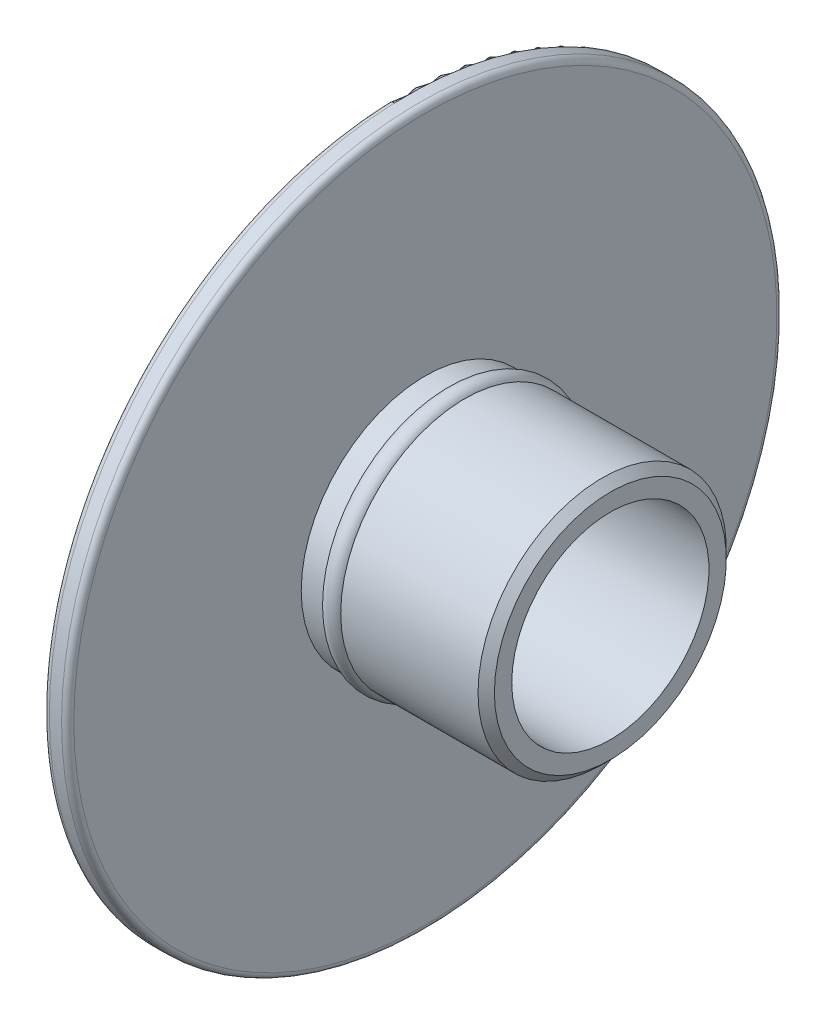
from build123d import *

# Parameters (mm, degrees)
SKETCH2_W          = 1.2
SKETCH2_H          = 12.675438596
CHAMFER2_SIZE      = 0.4
FILLET1_R          = 0.3
CUT_EXTRUDE2_DEPTH = 0.6
FILLET2_R          = 0.3


with BuildPart() as part:
    # Sketch2 → Revolve1 (revolve)
    with BuildSketch(Plane.XY):
        with Locations((-5.85, 11.162280702)):
            Rectangle(SKETCH2_W, SKETCH2_H)
    revolve(axis=Axis((0, 0, 0), (1, 0, 0)))

    # Sketch4 → Revolve2 (revolve)
    with BuildSketch(Plane.XY):
        with BuildLine():
            Line((-5.25, 6.074561404), (-5.25, 4.824561404))
            Line((-5.25, 4.824561404), (3.8, 4.824561404))
            Line((3.8, 4.824561404), (3.8, 6.074561404))
            Line((3.8, 6.074561404), (-3.316987298, 6.074561404))
            ThreePointArc((-3.316987298, 6.074561404), (-3.75, 6.324561404), (-4.183012702, 6.074561404))
            Line((-4.183012702, 6.074561404), (-5.25, 6.074561404))
        make_face()
    revolve(axis=Axis((0, 0, 0), (1, 0, 0)))

    # Chamfer2
    chamfer2_edges = [part.edges().sort_by_distance(p)[0] for p in [
        (3.8, -6.074561404, 0),
    ]]
    chamfer(chamfer2_edges, length=CHAMFER2_SIZE)

    # Fillet1
    fillet1_edges = [part.edges().sort_by_distance(p)[0] for p in [
        (-5.25, -17.5, 0),
        (-6.45, -17.5, 0),
    ]]
    fillet(fillet1_edges, radius=FILLET1_R)

    # Sketch3<3> → Cut-Extrude2 (cut)
    with BuildSketch(Plane.ZY.offset(6.45)):
        with BuildLine():
            ThreePointArc((4.517828644, 5.048158729), (2.592512411, 6.258878622), (0.375, 6.76417454))
            Line((0.375, 6.76417454), (0.375, 5.561934002))
            ThreePointArc((0.375, 5.561934002), (2.133292292, 5.150223183), (3.667716206, 4.198046292))
            Line((3.667716206, 4.198046292), (4.517828644, 5.048158729))
        make_face()
        with BuildLine():
            ThreePointArc((6.76417454, 0.375), (6.258878622, 2.592512411), (5.048158729, 4.517828644))
            Line((5.048158729, 4.517828644), (4.198046292, 3.667716206))
            ThreePointArc((4.198046292, 3.667716206), (5.150223183, 2.133292292), (5.561934002, 0.375))
            Line((5.561934002, 0.375), (6.76417454, 0.375))
        make_face()
        with BuildLine():
            ThreePointArc((5.048158729, -4.517828644), (6.258878622, -2.592512411), (6.76417454, -0.375))
            Line((6.76417454, -0.375), (5.561934002, -0.375))
            ThreePointArc((5.561934002, -0.375), (5.150223183, -2.133292292), (4.198046292, -3.667716206))
            Line((4.198046292, -3.667716206), (5.048158729, -4.517828644))
        make_face()
        with BuildLine():
            ThreePointArc((0.375, -6.76417454), (2.592512411, -6.258878622), (4.517828644, -5.048158729))
            Line((4.517828644, -5.048158729), (3.667716206, -4.198046292))
            ThreePointArc((3.667716206, -4.198046292), (2.133292292, -5.150223183), (0.375, -5.561934002))
            Line((0.375, -5.561934002), (0.375, -6.76417454))
        make_face()
        with BuildLine():
            ThreePointArc((-4.517828644, -5.048158729), (-2.592512411, -6.258878622), (-0.375, -6.76417454))
            Line((-0.375, -6.76417454), (-0.375, -5.561934002))
            ThreePointArc((-0.375, -5.561934002), (-2.133292292, -5.150223183), (-3.667716206, -4.198046292))
            Line((-3.667716206, -4.198046292), (-4.517828644, -5.048158729))
        make_face()
        with BuildLine():
            ThreePointArc((-6.76417454, -0.375), (-6.258878622, -2.592512411), (-5.048158729, -4.517828644))
            Line((-5.048158729, -4.517828644), (-4.198046292, -3.667716206))
            ThreePointArc((-4.198046292, -3.667716206), (-5.150223183, -2.133292292), (-5.561934002, -0.375))
            Line((-5.561934002, -0.375), (-6.76417454, -0.375))
        make_face()
        with BuildLine():
            ThreePointArc((-5.048158729, 4.517828644), (-6.258878622, 2.592512411), (-6.76417454, 0.375))
            Line((-6.76417454, 0.375), (-5.561934002, 0.375))
            ThreePointArc((-5.561934002, 0.375), (-5.150223183, 2.133292292), (-4.198046292, 3.667716206))
            Line((-4.198046292, 3.667716206), (-5.048158729, 4.517828644))
        make_face()
        with BuildLine():
            ThreePointArc((-0.375, 6.76417454), (-2.592512411, 6.258878622), (-4.517828644, 5.048158729))
            Line((-4.517828644, 5.048158729), (-3.667716206, 4.198046292))
            ThreePointArc((-3.667716206, 4.198046292), (-2.133292292, 5.150223183), (-0.375, 5.561934002))
            Line((-0.375, 5.561934002), (-0.375, 6.76417454))
        make_face()
    extrude(amount=-CUT_EXTRUDE2_DEPTH, mode=Mode.SUBTRACT)

    # Fillet2
    fillet2_edges = [part.edges().sort_by_distance(p)[0] for p in [
        (-6.15, 0.375, 5.561934002),
        (-6.15, 0.375, 6.76417454),
        (-6.15, 4.517828644, 5.048158729),
        (-6.15, 3.667716206, 4.198046292),
        (-6.15, -0.375, -5.561934002),
        (-6.15, -0.375, -6.76417454),
        (-6.15, -4.517828644, -5.048158729),
        (-6.15, -3.667716206, -4.198046292),
        (-6.15, 5.561934002, -0.375),
        (-6.15, 6.76417454, -0.375),
        (-6.15, 5.048158729, -4.517828644),
        (-6.15, 4.198046292, -3.667716206),
        (-6.15, -3.667716206, 4.198046292),
        (-6.15, -4.517828644, 5.048158729),
        (-6.15, -0.375, 6.76417454),
        (-6.15, -0.375, 5.561934002),
        (-6.15, 5.048158729, 4.517828644),
        (-6.15, 5.561934002, 0.375),
        (-6.15, 4.198046292, 3.667716206),
        (-6.15, 3.667716206, -4.198046292),
        (-6.15, 4.517828644, -5.048158729),
        (-6.15, 0.375, -6.76417454),
        (-6.15, 0.375, -5.561934002),
        (-6.15, -4.198046292, -3.667716206),
        (-6.15, -5.048158729, -4.517828644),
        (-6.15, -6.76417454, -0.375),
        (-6.15, -5.561934002, -0.375),
        (-6.15, -5.561934002, 0.375),
        (-6.15, -6.76417454, 0.375),
        (-6.15, -5.048158729, 4.517828644),
        (-6.15, -4.198046292, 3.667716206),
        (-6.15, 6.76417454, 0.375),
    ]]
    fillet(fillet2_edges, radius=FILLET2_R)


solid = part.part
